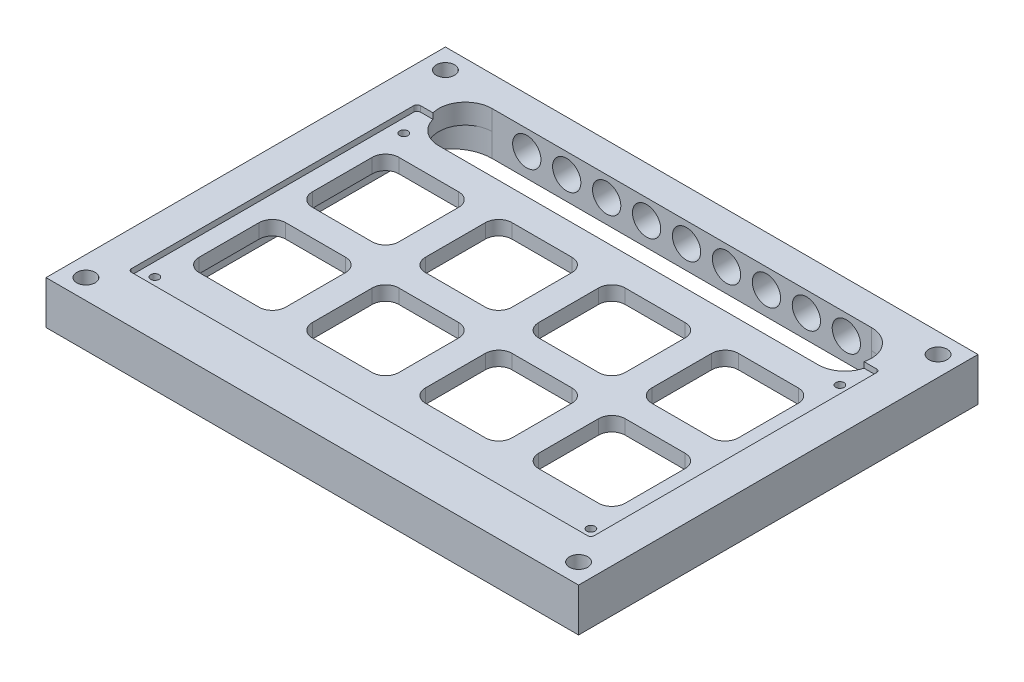
from build123d import *

# Parameters (mm, degrees)
ESQUISSE1_W                                   = 160
ESQUISSE1_H                                   = 120
BOSS_EXTRU_1_DEPTH                            = 13
ESQUISSE5_R                                   = 4.25
ENL_V_MAT_EXTRU_2_DEPTH                       = 12
ENL_V_MAT_EXTRU_6_DEPTH                       = 2
ENL_V_MAT_EXTRU_1_DEPTH                       = 7
ENL_V_MAT_EXTRU_3_DEPTH                       = 165.517759053
ENL_V_MAT_EXTRU_5_DEPTH                       = 165.517759053
D_GAGEMENT_M51_D                              = 5.5
ENL_V_MAT_EXTRU_7_DEPTH                       = 1.7
TROU_POUR_TARAUDAGE_POUR_TROU_TARAUD_M3_D     = 2.5
TROU_POUR_TARAUDAGE_POUR_TROU_TARAUD_M3_DEPTH = 3
TROU_POUR_TARAUDAGE_POUR_TROU_TARAUD_M3_TIP   = 0.751075774


with BuildPart() as part:
    # Esquisse1 → Boss.-Extru.1 (new body)
    with BuildSketch(Plane(origin=(0, 0, 0), x_dir=(1, 0, 0), z_dir=(0, 1, 0))):
        with Locations((-65.175406235, -17.079144186)):
            Rectangle(ESQUISSE1_W, ESQUISSE1_H)
    extrude(amount=BOSS_EXTRU_1_DEPTH)

    # Esquisse5 → Enlèv. mat.-Extru.2 (cut)
    with BuildSketch(Plane(origin=(0, 0, -42.920855814), x_dir=(-1, 0, 0), z_dir=(0, 0, -1))):
        with Locations((111.732954037, 7)):
            Circle(ESQUISSE5_R)
        with Locations((99.732954037, 7)):
            Circle(ESQUISSE5_R)
        with Locations((87.732954037, 7)):
            Circle(ESQUISSE5_R)
        with Locations((75.732954037, 7)):
            Circle(ESQUISSE5_R)
        with Locations((63.732954037, 7)):
            Circle(ESQUISSE5_R)
        with Locations((51.732954037, 7)):
            Circle(ESQUISSE5_R)
        with Locations((39.732954037, 7)):
            Circle(ESQUISSE5_R)
        with Locations((27.732954037, 7)):
            Circle(ESQUISSE5_R)
        with Locations((15.732954037, 7)):
            Circle(ESQUISSE5_R)
    extrude(amount=-ENL_V_MAT_EXTRU_2_DEPTH, mode=Mode.SUBTRACT)

    # Esquisse11 → Enlèv. mat.-Extru.6 (cut)
    with BuildSketch(Plane.XZ):
        with BuildLine():
            Line((-126.175406235, 71.079144186), (-4.175406235, 71.079144186))
            ThreePointArc((-4.175406235, 71.079144186), (5.724088702, 66.978639123), (9.824593765, 57.079144186))
            Line((9.824593765, 57.079144186), (9.824593765, -24.920855814))
            ThreePointArc((9.824593765, -24.920855814), (5.724088702, -34.82035075), (-4.175406235, -38.920855814))
            Line((-4.175406235, -38.920855814), (-126.175406235, -38.920855814))
            ThreePointArc((-126.175406235, -38.920855814), (-136.074901171, -34.82035075), (-140.175406235, -24.920855814))
            Line((-140.175406235, -24.920855814), (-140.175406235, 57.079144186))
            ThreePointArc((-140.175406235, 57.079144186), (-136.074901171, 66.978639123), (-126.175406235, 71.079144186))
        make_face()
        with BuildLine():
            Line((-137.175406235, 57.079144186), (-137.175406235, -24.920855814))
            ThreePointArc((-137.175406235, -24.920855814), (-133.953580828, -32.699030407), (-126.175406235, -35.920855814))
            Line((-126.175406235, -35.920855814), (-4.175406235, -35.920855814))
            ThreePointArc((-4.175406235, -35.920855814), (3.602768359, -32.699030407), (6.824593765, -24.920855814))
            Line((6.824593765, -24.920855814), (6.824593765, 57.079144186))
            ThreePointArc((6.824593765, 57.079144186), (3.602768359, 64.857318779), (-4.175406235, 68.079144186))
            Line((-4.175406235, 68.079144186), (-126.175406235, 68.079144186))
            ThreePointArc((-126.175406235, 68.079144186), (-133.953580828, 64.857318779), (-137.175406235, 57.079144186))
        make_face(mode=Mode.SUBTRACT)
    extrude(amount=-ENL_V_MAT_EXTRU_6_DEPTH, mode=Mode.SUBTRACT)

    # Esquisse4 → Enlèv. mat.-Extru.1 (cut)
    with BuildSketch(Plane.XZ):
        with BuildLine():
            Line((-122.175406235, 65.079144186), (-8.175406235, 65.079144186))
            ThreePointArc((-8.175406235, 65.079144186), (0.30987514, 61.564425561), (3.824593765, 53.079144186))
            Line((3.824593765, 53.079144186), (3.824593765, -21.920855814))
            ThreePointArc((3.824593765, -21.920855814), (0.30987514, -30.406137188), (-8.175406235, -33.920855814))
            Line((-8.175406235, -33.920855814), (-122.175406235, -33.920855814))
            ThreePointArc((-122.175406235, -33.920855814), (-130.660687609, -30.406137188), (-134.175406235, -21.920855814))
            Line((-134.175406235, -21.920855814), (-134.175406235, 53.079144186))
            ThreePointArc((-134.175406235, 53.079144186), (-130.660687609, 61.564425561), (-122.175406235, 65.079144186))
        make_face()
    extrude(amount=-ENL_V_MAT_EXTRU_1_DEPTH, mode=Mode.SUBTRACT)

    # Esquisse6 → Enlèv. mat.-Extru.3 (cut, through all)
    with BuildSketch(Plane.XZ.offset(-7)):
        with BuildLine():
            Line((-91.175406235, 25.079144186), (-73.175406235, 25.079144186))
            ThreePointArc((-73.175406235, 25.079144186), (-70.34697911, 26.250717062), (-69.175406235, 29.079144186))
            Line((-69.175406235, 29.079144186), (-69.175406235, 47.079144186))
            ThreePointArc((-69.175406235, 47.079144186), (-70.34697911, 49.907571311), (-73.175406235, 51.079144186))
            Line((-73.175406235, 51.079144186), (-91.175406235, 51.079144186))
            ThreePointArc((-91.175406235, 51.079144186), (-94.003833359, 49.907571311), (-95.175406235, 47.079144186))
            Line((-95.175406235, 47.079144186), (-95.175406235, 29.079144186))
            ThreePointArc((-95.175406235, 29.079144186), (-94.003833359, 26.250717062), (-91.175406235, 25.079144186))
        make_face()
        with BuildLine():
            Line((-125.175406235, 51.079144186), (-107.175406235, 51.079144186))
            ThreePointArc((-107.175406235, 51.079144186), (-104.34697911, 49.907571311), (-103.175406235, 47.079144186))
            Line((-103.175406235, 47.079144186), (-103.175406235, 29.079144186))
            ThreePointArc((-103.175406235, 29.079144186), (-104.34697911, 26.250717062), (-107.175406235, 25.079144186))
            Line((-107.175406235, 25.079144186), (-125.175406235, 25.079144186))
            ThreePointArc((-125.175406235, 25.079144186), (-128.003833359, 26.250717062), (-129.175406235, 29.079144186))
            Line((-129.175406235, 29.079144186), (-129.175406235, 47.079144186))
            ThreePointArc((-129.175406235, 47.079144186), (-128.003833359, 49.907571311), (-125.175406235, 51.079144186))
        make_face()
        with BuildLine():
            Line((-57.175406235, 25.079144186), (-39.175406235, 25.079144186))
            ThreePointArc((-39.175406235, 25.079144186), (-36.34697911, 26.250717062), (-35.175406235, 29.079144186))
            Line((-35.175406235, 29.079144186), (-35.175406235, 47.079144186))
            ThreePointArc((-35.175406235, 47.079144186), (-36.34697911, 49.907571311), (-39.175406235, 51.079144186))
            Line((-39.175406235, 51.079144186), (-57.175406235, 51.079144186))
            ThreePointArc((-57.175406235, 51.079144186), (-60.003833359, 49.907571311), (-61.175406235, 47.079144186))
            Line((-61.175406235, 47.079144186), (-61.175406235, 29.079144186))
            ThreePointArc((-61.175406235, 29.079144186), (-60.003833359, 26.250717062), (-57.175406235, 25.079144186))
        make_face()
        with BuildLine():
            Line((-23.175406235, 25.079144186), (-5.175406235, 25.079144186))
            ThreePointArc((-5.175406235, 25.079144186), (-2.34697911, 26.250717062), (-1.175406235, 29.079144186))
            Line((-1.175406235, 29.079144186), (-1.175406235, 47.079144186))
            ThreePointArc((-1.175406235, 47.079144186), (-2.34697911, 49.907571311), (-5.175406235, 51.079144186))
            Line((-5.175406235, 51.079144186), (-23.175406235, 51.079144186))
            ThreePointArc((-23.175406235, 51.079144186), (-26.003833359, 49.907571311), (-27.175406235, 47.079144186))
            Line((-27.175406235, 47.079144186), (-27.175406235, 29.079144186))
            ThreePointArc((-27.175406235, 29.079144186), (-26.003833359, 26.250717062), (-23.175406235, 25.079144186))
        make_face()
        with BuildLine():
            Line((-91.175406235, -8.920855814), (-73.175406235, -8.920855814))
            ThreePointArc((-73.175406235, -8.920855814), (-70.34697911, -7.749282938), (-69.175406235, -4.920855814))
            Line((-69.175406235, -4.920855814), (-69.175406235, 13.079144186))
            ThreePointArc((-69.175406235, 13.079144186), (-70.34697911, 15.907571311), (-73.175406235, 17.079144186))
            Line((-73.175406235, 17.079144186), (-91.175406235, 17.079144186))
            ThreePointArc((-91.175406235, 17.079144186), (-94.003833359, 15.907571311), (-95.175406235, 13.079144186))
            Line((-95.175406235, 13.079144186), (-95.175406235, -4.920855814))
            ThreePointArc((-95.175406235, -4.920855814), (-94.003833359, -7.749282938), (-91.175406235, -8.920855814))
        make_face()
        with BuildLine():
            Line((-57.175406235, -8.920855814), (-39.175406235, -8.920855814))
            ThreePointArc((-39.175406235, -8.920855814), (-36.34697911, -7.749282938), (-35.175406235, -4.920855814))
            Line((-35.175406235, -4.920855814), (-35.175406235, 13.079144186))
            ThreePointArc((-35.175406235, 13.079144186), (-36.34697911, 15.907571311), (-39.175406235, 17.079144186))
            Line((-39.175406235, 17.079144186), (-57.175406235, 17.079144186))
            ThreePointArc((-57.175406235, 17.079144186), (-60.003833359, 15.907571311), (-61.175406235, 13.079144186))
            Line((-61.175406235, 13.079144186), (-61.175406235, -4.920855814))
            ThreePointArc((-61.175406235, -4.920855814), (-60.003833359, -7.749282938), (-57.175406235, -8.920855814))
        make_face()
        with BuildLine():
            Line((-23.175406235, -8.920855814), (-5.175406235, -8.920855814))
            ThreePointArc((-5.175406235, -8.920855814), (-2.34697911, -7.749282938), (-1.175406235, -4.920855814))
            Line((-1.175406235, -4.920855814), (-1.175406235, 13.079144186))
            ThreePointArc((-1.175406235, 13.079144186), (-2.34697911, 15.907571311), (-5.175406235, 17.079144186))
            Line((-5.175406235, 17.079144186), (-23.175406235, 17.079144186))
            ThreePointArc((-23.175406235, 17.079144186), (-26.003833359, 15.907571311), (-27.175406235, 13.079144186))
            Line((-27.175406235, 13.079144186), (-27.175406235, -4.920855814))
            ThreePointArc((-27.175406235, -4.920855814), (-26.003833359, -7.749282938), (-23.175406235, -8.920855814))
        make_face()
        with BuildLine():
            Line((-125.175406235, -8.920855814), (-107.175406235, -8.920855814))
            ThreePointArc((-107.175406235, -8.920855814), (-104.34697911, -7.749282938), (-103.175406235, -4.920855814))
            Line((-103.175406235, -4.920855814), (-103.175406235, 13.079144186))
            ThreePointArc((-103.175406235, 13.079144186), (-104.34697911, 15.907571311), (-107.175406235, 17.079144186))
            Line((-107.175406235, 17.079144186), (-125.175406235, 17.079144186))
            ThreePointArc((-125.175406235, 17.079144186), (-128.003833359, 15.907571311), (-129.175406235, 13.079144186))
            Line((-129.175406235, 13.079144186), (-129.175406235, -4.920855814))
            ThreePointArc((-129.175406235, -4.920855814), (-128.003833359, -7.749282938), (-125.175406235, -8.920855814))
        make_face()
    extrude(amount=-ENL_V_MAT_EXTRU_3_DEPTH, mode=Mode.SUBTRACT)

    # Esquisse8 → Enlèv. mat.-Extru.5 (cut, through all)
    with BuildSketch(Plane.XZ.offset(-7)):
        with BuildLine():
            Line((-122.175406235, -17.920855814), (-8.175406235, -17.920855814))
            ThreePointArc((-8.175406235, -17.920855814), (-0.175406235, -25.920855814), (-8.175406235, -33.920855814))
            Line((-8.175406235, -33.920855814), (-122.175406235, -33.920855814))
            ThreePointArc((-122.175406235, -33.920855814), (-130.175406235, -25.920855814), (-122.175406235, -17.920855814))
        make_face()
    extrude(amount=-ENL_V_MAT_EXTRU_5_DEPTH, mode=Mode.SUBTRACT)

    # Dégagement M51 (through all)
    with Locations(Plane(origin=(0, 0, 0), x_dir=(-1, 0, 0), z_dir=(0, -1, 0))):
        with Locations((139.175406235, 36.920855814), (139.175406235, -71.079144186), (-8.824593765, -71.079144186), (-8.824593765, 36.920855814)):
            Hole(D_GAGEMENT_M51_D / 2)

    # Esquisse13 → Enlèv. mat.-Extru.7 (cut)
    with BuildSketch(Plane(origin=(0, 13, 0), x_dir=(1, 0, 0), z_dir=(0, 1, 0))):
        with BuildLine():
            Line((3.324593765, -62.879144186), (-133.675406235, -62.879144186))
            ThreePointArc((-133.675406235, -62.879144186), (-134.382513016, -62.586250967), (-134.675406235, -61.879144186))
            Line((-134.675406235, -61.879144186), (-134.675406235, 22.920855814))
            ThreePointArc((-134.675406235, 22.920855814), (-134.382513016, 23.627962595), (-133.675406235, 23.920855814))
            Line((-133.675406235, 23.920855814), (3.324593765, 23.920855814))
            ThreePointArc((3.324593765, 23.920855814), (4.031700547, 23.627962595), (4.324593765, 22.920855814))
            Line((4.324593765, 22.920855814), (4.324593765, -61.879144186))
            ThreePointArc((4.324593765, -61.879144186), (4.031700547, -62.586250967), (3.324593765, -62.879144186))
        make_face()
    extrude(amount=-ENL_V_MAT_EXTRU_7_DEPTH, mode=Mode.SUBTRACT)

    # Trou pour taraudage pour trou taraudé M31
    with Locations(Plane(origin=(0, 11.3, 0), x_dir=(1, 0, 0), z_dir=(0, 1, 0))):
        with Locations((0.324593765, -58.879144186), (-130.675406235, -58.879144186), (-130.675406235, 15.920855814), (0.324593765, 15.920855814)):
            Hole(TROU_POUR_TARAUDAGE_POUR_TROU_TARAUD_M3_D / 2, depth=TROU_POUR_TARAUDAGE_POUR_TROU_TARAUD_M3_DEPTH)
            with Locations((0, 0, -(TROU_POUR_TARAUDAGE_POUR_TROU_TARAUD_M3_DEPTH + TROU_POUR_TARAUDAGE_POUR_TROU_TARAUD_M3_TIP / 2))):  # 118° drill point
                Cone(0, TROU_POUR_TARAUDAGE_POUR_TROU_TARAUD_M3_D / 2, TROU_POUR_TARAUDAGE_POUR_TROU_TARAUD_M3_TIP, mode=Mode.SUBTRACT)


solid = part.part
